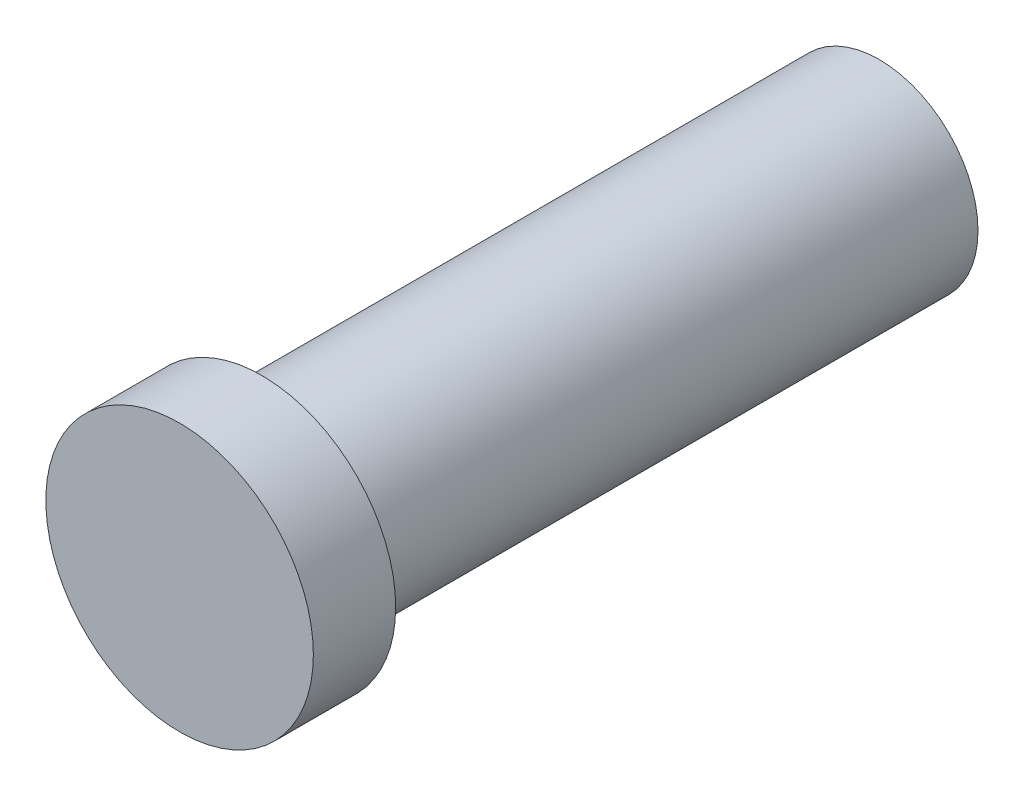
from build123d import *

# Parameters (mm, degrees)
SKETCH1_R           = 4.8
BOSS_EXTRUDE1_DEPTH = 30
SKETCH2_R           = 6.5
BOSS_EXTRUDE2_DEPTH = 4
SKETCH3_R           = 3.5
CUT_EXTRUDE1_DEPTH  = 15
CUT_EXTRUDE1_DRAFT  = -6


with BuildPart() as part:
    # Sketch1 → Boss-Extrude1 (new body)
    with BuildSketch(Plane.XY):
        Circle(SKETCH1_R)
    extrude(amount=BOSS_EXTRUDE1_DEPTH)

    # Sketch2 → Boss-Extrude2 (add)
    with BuildSketch(Plane.XY.offset(30)):
        Circle(SKETCH2_R)
    extrude(amount=BOSS_EXTRUDE2_DEPTH)


with BuildPart() as cut_extrude1_tool:
    # Sketch3 → Cut-Extrude1 (with draft: the straight prism first)
    with BuildSketch(Plane(origin=(0, 0, 0), x_dir=(-1, 0, 0), z_dir=(0, 0, -1))):
        Circle(SKETCH3_R)
    extrude(amount=-CUT_EXTRUDE1_DEPTH)
    # Cut-Extrude1: the draft: its side faces are tilted about the plane it starts from
    cut_extrude1_sides = [cut_extrude1_tool.faces().sort_by_distance(p)[0] for p in [
        (3.5, 0, 7.5),
    ]]
    draft(cut_extrude1_sides, Plane(origin=(0, 0, 0), x_dir=(-1, 0, 0), z_dir=(0, 0, -1)), CUT_EXTRUDE1_DRAFT)


with BuildPart() as part_1:
    add(part.part)

    # Cut-Extrude1: cut by cut_extrude1_tool
    add(cut_extrude1_tool.part, mode=Mode.SUBTRACT)


solid = part_1.part
